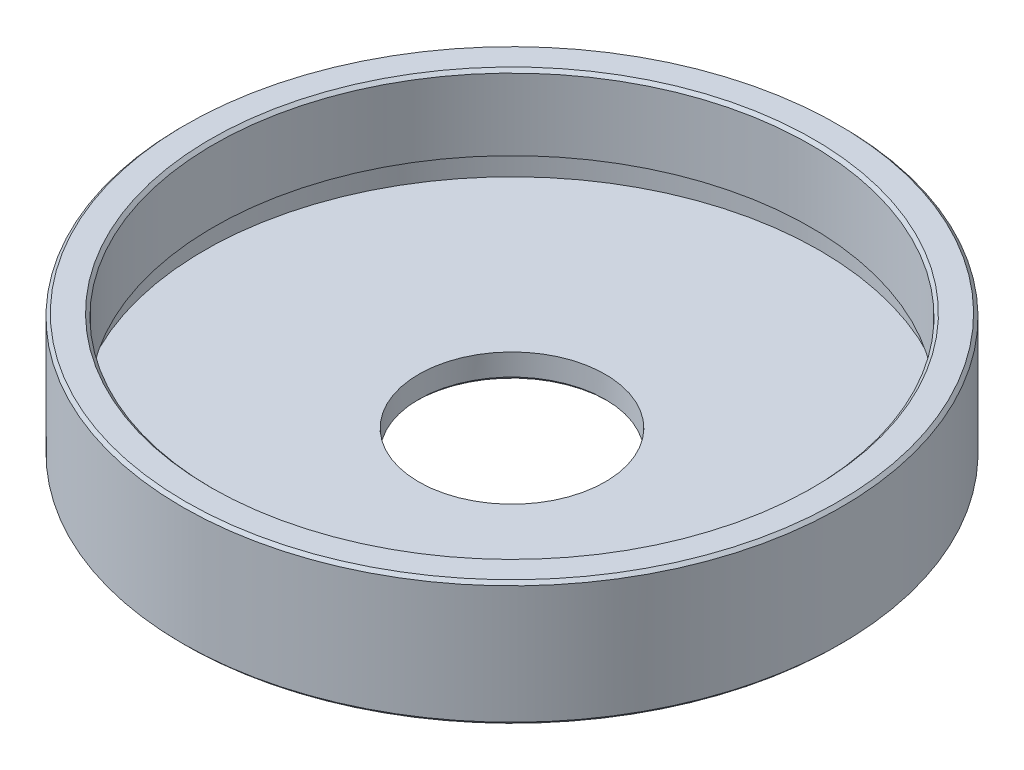
from build123d import *

# Parameters (mm, degrees)
CHAMFER_1_SIZE = 0.5


with BuildPart() as part:
    # Эскиз1 → Повернуть1 (revolve)
    with BuildSketch(Plane.XY):
        Polygon((-53, 20), (-53, 0), (-15, 0), (-15, 4), (-49.5, 4), (-49.5, 8), (-48, 8), (-48, 20), align=None)
    revolve(axis=Axis((0, 26.168985987, 0), (0, -1, 0)))

    # Фаска1
    chamfer_1_edges = [part.edges().sort_by_distance(p)[0] for p in [
        (15, 0, 0),
        (53, 0, 0),
        (53, 20, 0),
        (48, 20, 0),
    ]]
    chamfer(chamfer_1_edges, length=CHAMFER_1_SIZE)


solid = part.part
